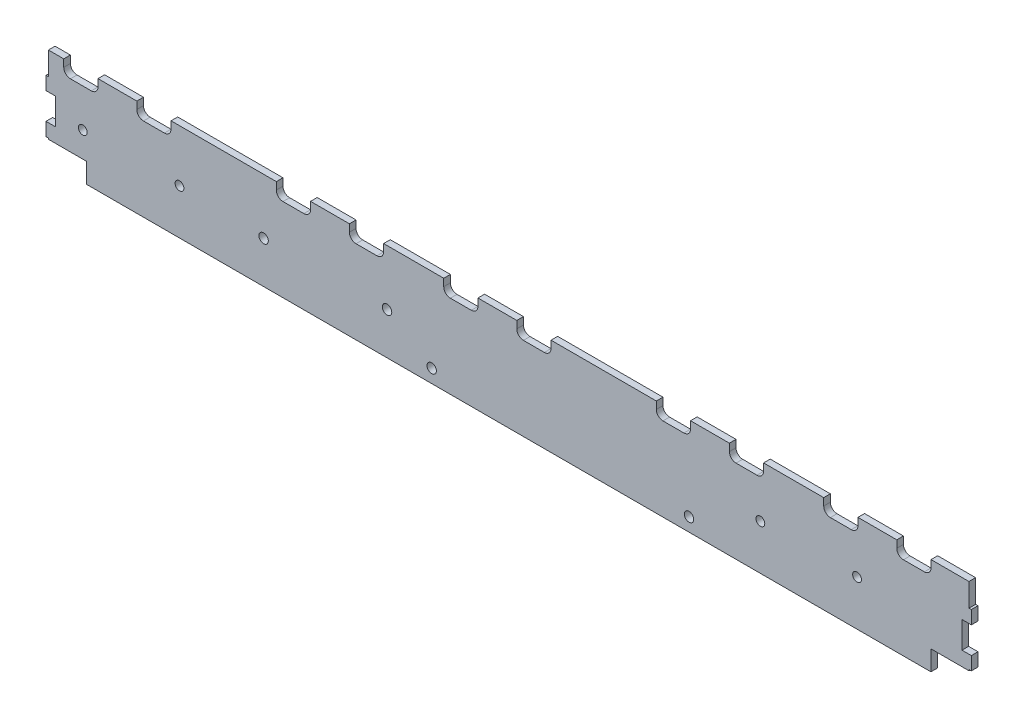
from build123d import *

# Parameters (mm, degrees)
BOSS_EXTRUDE1_DEPTH = 3.175
SKETCH4_R           = 2.1
SKETCH4_R_2         = 2.249999999
SKETCH4_R_3         = 2.25
CUT_EXTRUDE2_DEPTH  = 343.045224939


with BuildPart() as part:
    # Sketch2 → Boss-Extrude1 (new body)
    with BuildSketch(Plane.XY):
        with BuildLine():
            Line((-166.376823509, -157.21600002), (-166.376823509, -168.26500002))
            Line((-166.376823509, -168.26500002), (-167.519823509, -168.26500002))
            Line((-167.519823509, -168.26500002), (-167.519823509, -174.61500002))
            Line((-167.519823509, -174.61500002), (-163.058823509, -174.61500002))
            Line((-163.058823509, -174.61500002), (-163.058823509, -187.31500002))
            Line((-163.058823509, -187.31500002), (-167.519823509, -187.31500002))
            Line((-167.519823509, -187.31500002), (-167.519823509, -193.66500002))
            Line((-167.519823509, -193.66500002), (-166.376823509, -193.66500002))
            Line((-166.376823509, -193.66500002), (-166.376823509, -194.18100002))
            Line((-166.376823509, -194.18100002), (-148.199823509, -194.18100002))
            Line((-148.199823509, -194.18100002), (-148.199823509, -203.71400002))
            Line((-148.199823509, -203.71400002), (255.426176451, -203.71400002))
            Line((255.426176451, -203.71400002), (255.426176451, -194.18100002))
            Line((255.426176451, -194.18100002), (273.603176451, -194.18100002))
            Line((273.603176451, -194.18100002), (273.603176451, -193.66500002))
            Line((273.603176451, -193.66500002), (274.746176451, -193.66500002))
            Line((274.746176451, -193.66500002), (274.746176451, -187.31500002))
            Line((274.746176451, -187.31500002), (270.285176451, -187.31500002))
            Line((270.285176451, -187.31500002), (270.285176451, -174.61500002))
            Line((270.285176451, -174.61500002), (274.746176451, -174.61500002))
            Line((274.746176451, -174.61500002), (274.746176451, -168.26500002))
            Line((274.746176451, -168.26500002), (273.603176451, -168.26500002))
            Line((273.603176451, -168.26500002), (273.603176451, -157.21600002))
            Line((273.603176451, -157.21600002), (255.463301471, -157.21600002))
            Line((255.463301471, -157.21600002), (255.463301471, -160.70800002))
            ThreePointArc((255.463301471, -160.70800002), (254.533365501, -162.95306405), (252.288301471, -163.88300002))
            Line((252.288301471, -163.88300002), (242.288301471, -163.88300002))
            ThreePointArc((242.288301471, -163.88300002), (240.04323744, -162.95306405), (239.113301471, -160.70800002))
            Line((239.113301471, -160.70800002), (239.113301471, -157.21600002))
            Line((239.113301471, -157.21600002), (220.538301471, -157.21600002))
            Line((220.538301471, -157.21600002), (220.538301471, -160.70800002))
            ThreePointArc((220.538301471, -160.70800002), (219.608365501, -162.95306405), (217.363301471, -163.88300002))
            Line((217.363301471, -163.88300002), (207.363301471, -163.88300002))
            ThreePointArc((207.363301471, -163.88300002), (205.11823744, -162.95306405), (204.188301471, -160.70800002))
            Line((204.188301471, -160.70800002), (204.188301471, -157.21600002))
            Line((204.188301471, -157.21600002), (175.452051471, -157.21600002))
            Line((175.452051471, -157.21600002), (175.452051471, -160.70800002))
            ThreePointArc((175.452051471, -160.70800002), (174.522115501, -162.95306405), (172.277051471, -163.88300002))
            Line((172.277051471, -163.88300002), (162.277051471, -163.88300002))
            ThreePointArc((162.277051471, -163.88300002), (160.03198744, -162.95306405), (159.102051471, -160.70800002))
            Line((159.102051471, -160.70800002), (159.102051471, -157.21600002))
            Line((159.102051471, -157.21600002), (140.527051471, -157.21600002))
            Line((140.527051471, -157.21600002), (140.527051471, -160.70800002))
            ThreePointArc((140.527051471, -160.70800002), (139.597115501, -162.95306405), (137.352051471, -163.88300002))
            Line((137.352051471, -163.88300002), (127.352051471, -163.88300002))
            ThreePointArc((127.352051471, -163.88300002), (125.10698744, -162.95306405), (124.177051471, -160.70800002))
            Line((124.177051471, -160.70800002), (124.177051471, -157.21600002))
            Line((124.177051471, -157.21600002), (73.849301471, -157.21600002))
            Line((73.849301471, -157.21600002), (73.849301471, -160.70800002))
            ThreePointArc((73.849301471, -160.70800002), (72.919365501, -162.95306405), (70.674301471, -163.88300002))
            Line((70.674301471, -163.88300002), (60.674301471, -163.88300002))
            ThreePointArc((60.674301471, -163.88300002), (58.42923744, -162.95306405), (57.499301471, -160.70800002))
            Line((57.499301471, -160.70800002), (57.499301471, -157.21600002))
            Line((57.499301471, -157.21600002), (38.924301471, -157.21600002))
            Line((38.924301471, -157.21600002), (38.924301471, -160.70800002))
            ThreePointArc((38.924301471, -160.70800002), (37.994365501, -162.95306405), (35.749301471, -163.88300002))
            Line((35.749301471, -163.88300002), (25.749301471, -163.88300002))
            ThreePointArc((25.749301471, -163.88300002), (23.50423744, -162.95306405), (22.574301471, -160.70800002))
            Line((22.574301471, -160.70800002), (22.574301471, -157.21600002))
            Line((22.574301471, -157.21600002), (-6.161948529, -157.21600002))
            Line((-6.161948529, -157.21600002), (-6.161948529, -160.70800002))
            ThreePointArc((-6.161948529, -160.70800002), (-7.091884499, -162.95306405), (-9.336948529, -163.88300002))
            Line((-9.336948529, -163.88300002), (-19.336948529, -163.88300002))
            ThreePointArc((-19.336948529, -163.88300002), (-21.58201256, -162.95306405), (-22.511948529, -160.70800002))
            Line((-22.511948529, -160.70800002), (-22.511948529, -157.21600002))
            Line((-22.511948529, -157.21600002), (-41.086948529, -157.21600002))
            Line((-41.086948529, -157.21600002), (-41.086948529, -160.70800002))
            ThreePointArc((-41.086948529, -160.70800002), (-42.016884499, -162.95306405), (-44.261948529, -163.88300002))
            Line((-44.261948529, -163.88300002), (-54.261948529, -163.88300002))
            ThreePointArc((-54.261948529, -163.88300002), (-56.50701256, -162.95306405), (-57.436948529, -160.70800002))
            Line((-57.436948529, -160.70800002), (-57.436948529, -157.21600002))
            Line((-57.436948529, -157.21600002), (-107.764698529, -157.21600002))
            Line((-107.764698529, -157.21600002), (-107.764698529, -160.70800002))
            ThreePointArc((-107.764698529, -160.70800002), (-108.694634499, -162.95306405), (-110.939698529, -163.88300002))
            Line((-110.939698529, -163.88300002), (-120.939698529, -163.88300002))
            ThreePointArc((-120.939698529, -163.88300002), (-123.18476256, -162.95306405), (-124.114698529, -160.70800002))
            Line((-124.114698529, -160.70800002), (-124.114698529, -157.21600002))
            Line((-124.114698529, -157.21600002), (-142.689698529, -157.21600002))
            Line((-142.689698529, -157.21600002), (-142.689698529, -160.70800002))
            ThreePointArc((-142.689698529, -160.70800002), (-143.619634499, -162.95306405), (-145.864698529, -163.88300002))
            Line((-145.864698529, -163.88300002), (-155.864698529, -163.88300002))
            ThreePointArc((-155.864698529, -163.88300002), (-158.10976256, -162.95306405), (-159.039698529, -160.70800002))
            Line((-159.039698529, -160.70800002), (-159.039698529, -157.21600002))
            Line((-159.039698529, -157.21600002), (-166.376823509, -157.21600002))
        make_face()
    extrude(amount=BOSS_EXTRUDE1_DEPTH)

    # Sketch4 → Cut-Extrude2 (cut, through all)
    with BuildSketch(Plane.XY.offset(3.175)):
        with Locations((220.106176451, -182.10474)):
            Circle(SKETCH4_R)
        with Locations((173.906176451, -182.10474)):
            Circle(SKETCH4_R)
        with Locations((139.818076453, -197.329197783)):
            Circle(SKETCH4_R_2)
        with Locations((16.818076453, -197.329197783)):
            Circle(SKETCH4_R_2)
        with Locations((-4.519823509, -183.71400002)):
            Circle(SKETCH4_R_3)
        with Locations((-63.519823509, -183.71400002)):
            Circle(SKETCH4_R_3)
        with Locations((-103.723323529, -182.10474)):
            Circle(SKETCH4_R)
        with Locations((-149.923323529, -182.10474)):
            Circle(SKETCH4_R)
    extrude(amount=-CUT_EXTRUDE2_DEPTH, mode=Mode.SUBTRACT)


solid = part.part
